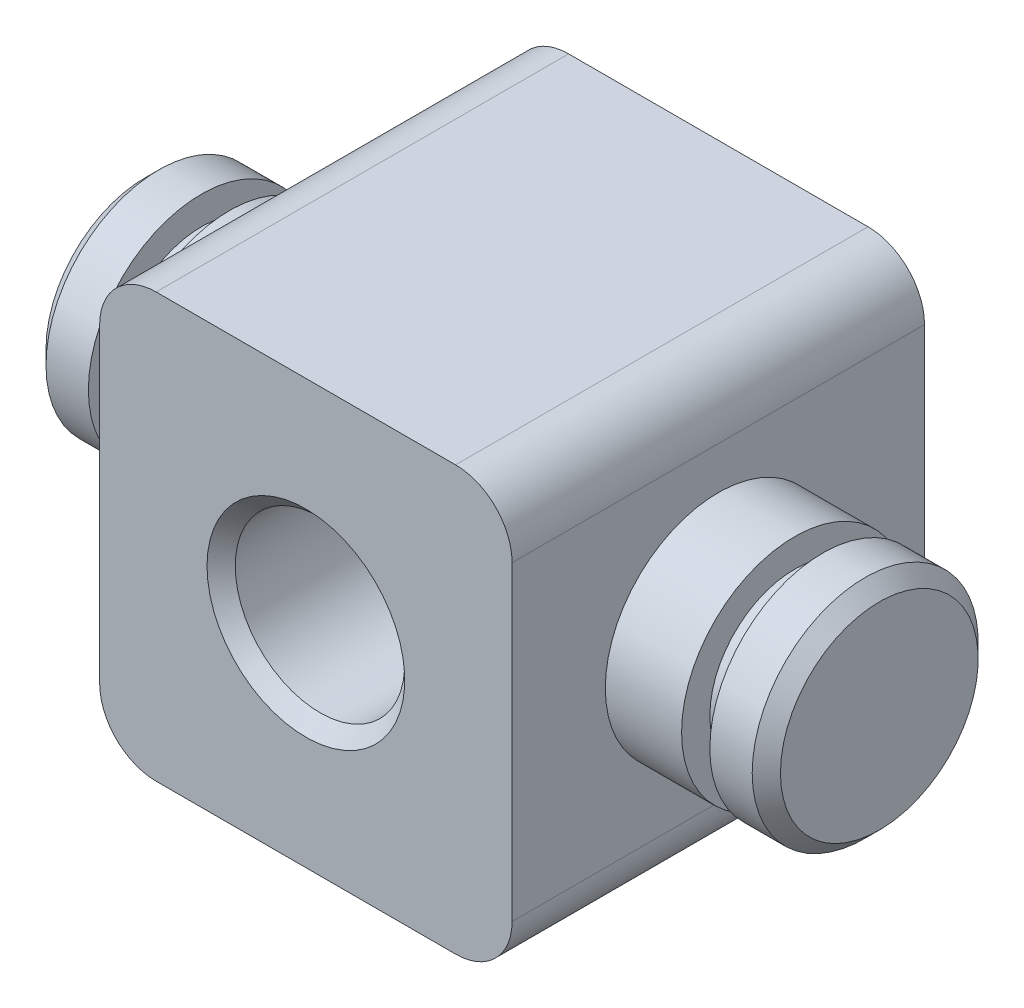
from build123d import *

# Parameters (mm, degrees)
SKETCH1_R           = 3
BOSS_EXTRUDE1_DEPTH = 7.3
CHAMFER1_SIZE       = 0.5


with BuildPart() as part:
    # Sketch1 → Boss-Extrude1 (new, symmetric)
    with BuildSketch(Plane.XY):
        with BuildLine():
            Line((-5.3, 7.5), (5.3, 7.5))
            ThreePointArc((5.3, 7.5), (6.714213562, 6.914213562), (7.3, 5.5))
            Line((7.3, 5.5), (7.3, -5.5))
            ThreePointArc((7.3, -5.5), (6.714213562, -6.914213562), (5.3, -7.5))
            Line((5.3, -7.5), (-5.3, -7.5))
            ThreePointArc((-5.3, -7.5), (-6.714213562, -6.914213562), (-7.3, -5.5))
            Line((-7.3, -5.5), (-7.3, 5.5))
            ThreePointArc((-7.3, 5.5), (-6.714213562, 6.914213562), (-5.3, 7.5))
        make_face()
        Circle(SKETCH1_R, mode=Mode.SUBTRACT)
    extrude(amount=BOSS_EXTRUDE1_DEPTH, both=True)

    # Sketch2 → Revolve1 (revolve)
    with BuildSketch(Plane.XY, mode=Mode.PRIVATE) as revolve1_sk:
        Polygon((7.3, 0), (7.3, 4), (10, 4), (10, 3), (11, 3), (11, 4), (12.5, 4), (13, 3.5), (13, 0), align=None)
        Polygon((-12.5, 4), (-13, 3.5), (-13, 0), (-7.3, 0), (-7.3, 4), (-10, 4), (-10, 3), (-11, 3), (-11, 4), align=None)
    revolve(revolve1_sk.sketch.rotate(Axis((-27.281048222, 0, 0), (1, 0, 0)), 90), axis=Axis((-27.281048222, 0, 0), (1, 0, 0)))

    # Chamfer1
    chamfer1_edges = [part.edges().sort_by_distance(p)[0] for p in [
        (-3, 0, -7.3),
        (-3, 0, 7.3),
    ]]
    chamfer(chamfer1_edges, length=CHAMFER1_SIZE)


solid = part.part
